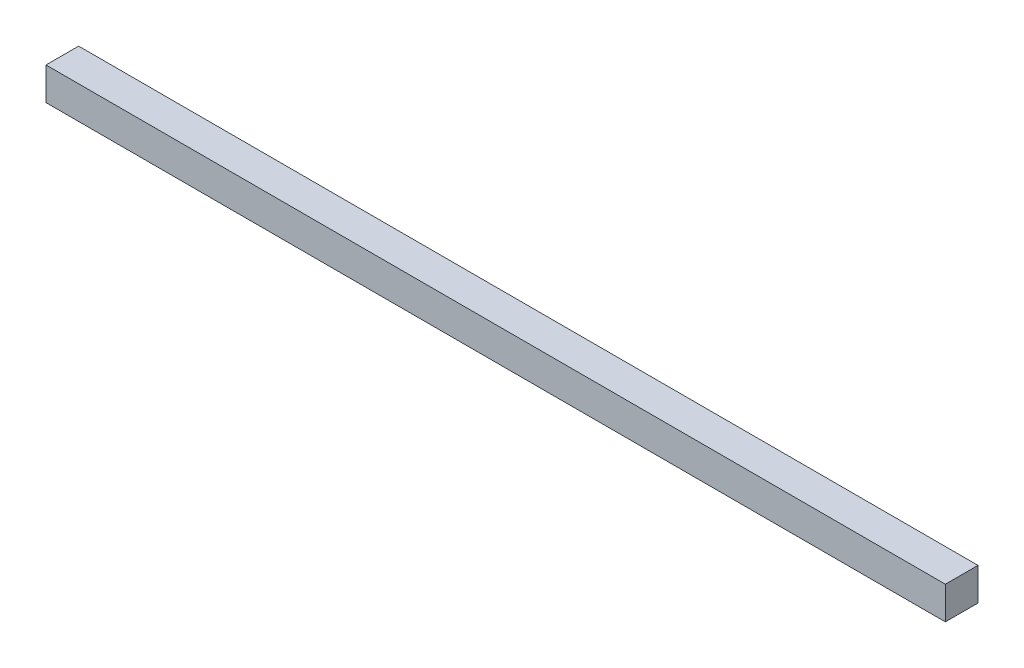
from build123d import *

# Parameters (mm, degrees)
BOSS_EXTRUDE1_DEPTH      = 124
BOSS_EXTRUDE1_DEPTH_BACK = 124
SKETCH2_W                = 9
SKETCH2_H                = 9


with BuildPart() as part:
    # Sketch2 → Boss-Extrude1 (new, two sides: drawn at the far end of the back side and taken through both)
    with BuildSketch(Plane(origin=(0, 0, 0), x_dir=(0, 0, -1), z_dir=(1, 0, 0)).offset(-BOSS_EXTRUDE1_DEPTH_BACK)):
        Rectangle(SKETCH2_W, SKETCH2_H)
    extrude(amount=BOSS_EXTRUDE1_DEPTH + BOSS_EXTRUDE1_DEPTH_BACK)


solid = part.part
